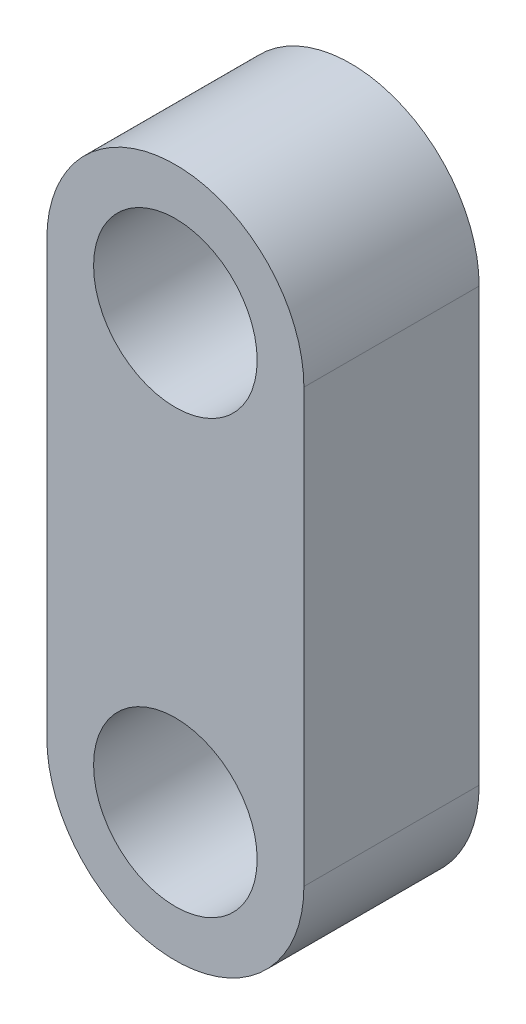
from build123d import *

# Parameters (mm, degrees)
SKETCH_1_R      = 7
EXTRUDE_1_DEPTH = 15


with BuildPart() as part:
    # 草图1 → 拉伸1 (new body)
    with BuildSketch(Plane.XY):
        with BuildLine():
            Line((0, 0), (0, -37))
            ThreePointArc((0, -37), (11, -48), (22, -37))
            Line((22, -37), (22, 0))
            ThreePointArc((22, 0), (11, 11), (0, 0))
        make_face()
        with Locations((11, 0)):
            Circle(SKETCH_1_R, mode=Mode.SUBTRACT)
        with Locations((11, -37)):
            Circle(SKETCH_1_R, mode=Mode.SUBTRACT)
    extrude(amount=EXTRUDE_1_DEPTH)


solid = part.part
